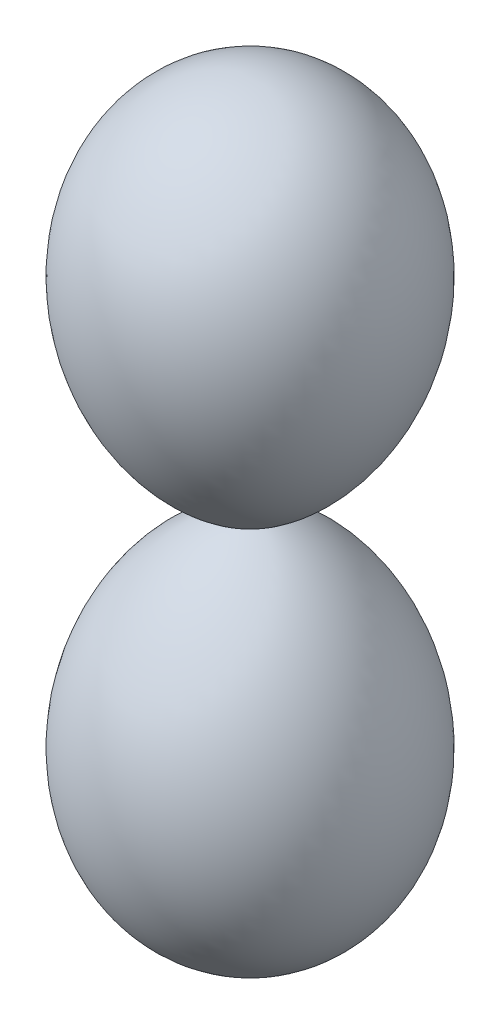
from build123d import *


with BuildPart() as part:
    # Sketch → Revolve 2 (revolve)
    with BuildSketch(Plane.XY):
        with BuildLine():
            Line((0, -238.732414638), (0, 238.732414638))
            add(Edge.make_bspline(
                [(0, -238.732414638), (0.158232077, -238.732414638), (0.457894285, -238.731206454), (1.334117241, -238.725769625), (1.734828689, -238.711272515), (2.784257101, -238.689529601), (3.327391603, -238.660544182), (4.233552235, -238.624320653), (4.899254924, -238.580864502), (5.710431999, -238.530182308), (6.439587273, -238.472281735), (7.209860068, -238.407171527), (7.960170326, -238.334861506), (8.906756192, -238.235487824), (10.036917619, -238.101885459), (11.35511682, -237.925140188), (12.856201705, -237.694636601), (14.35335864, -237.435761168), (15.844951617, -237.148667084), (17.331115392, -236.833522986), (18.810947316, -236.49051295), (20.284181817, -236.119835734), (21.750180597, -235.721704634), (23.208545184, -235.296346025), (24.658748895, -234.844000473), (27.181554623, -234.005610229), (30.028480641, -232.941574968), (33.877647352, -231.313146468), (38.643678262, -228.951040666), (43.263561166, -226.311100964), (48.321877745, -222.936136953), (53.140623494, -219.227520162), (57.704770636, -215.210068516), (62.002106448, -210.908728408), (66.023002229, -206.34820432), (69.760150606, -201.55267159), (73.208302609, -196.545553623), (76.363996406, -191.349371223), (79.225302096, -185.985647266), (81.791587919, -180.474849778), (84.063303795, -174.836385458), (86.041791902, -169.088614521), (87.729126693, -163.24886785), (89.12796924, -157.333494347), (90.241441271, -151.357929953), (91.07302349, -145.336752282), (91.626467605, -139.28375109), (91.975538229, -131.694052432), (91.854220286, -122.57372715), (90.94318358, -111.966525473), (88.880638241, -99.976126526), (85.830270711, -88.198658823), (81.824681155, -76.711163807), (76.895202809, -65.588766025), (71.071730211, -54.907072226), (64.382638242, -44.744327002), (56.854788086, -35.185318162), (48.513526697, -26.325007127), (39.382746375, -18.27765176), (29.558231014, -11.239903165), (20.330535609, -6.088717432), (12.744356959, -2.909332584), (7.123412248, -1.197500191), (3.89252896, -0.472067618), (2.073354847, -0.174511201), (0.897060134, -0.049334904), (0.384889492, -0.01495543), (0.237494877, -0.007187224), (0.128470358, -0.002714026), (0.05953241, -0.000834124), (0.021580243, -0.000158546), (0.006014563, -2.8815e-05), (0.002263326, -7.099e-06), (0.000617382, -2.078e-06), (0.000279755, 1.504e-06), (0.002101495, 6.27e-06), (0.005896718, 2.6536e-05), (0.011280533, 7.1356e-05), (0.03052891, 0.000303178), (0.07128192, 0.001104008), (0.141479089, 0.003230096), (0.24777748, 0.007660446), (0.387344121, 0.015233331), (0.765293896, 0.040289232), (1.763239686, 0.136675824), (3.363876167, 0.376889225), (6.364669635, 1.000735296), (11.598751558, 2.511836497), (18.836172109, 5.391762543), (27.774160676, 10.152677885), (37.363515, 16.712075114), (46.502114439, 24.426974972), (54.883388299, 32.95523492), (62.485054599, 42.183225458), (69.283344343, 52.016928437), (75.253240179, 62.373869961), (80.368208592, 73.178372549), (84.600317133, 84.358179263), (87.920268821, 95.842121808), (90.297507074, 107.55788476), (91.700492456, 119.43033589), (92.097083128, 131.379537209), (91.455224234, 143.319005121), (89.957859881, 153.674462156), (87.988294388, 162.41929114), (85.882244431, 169.582315917), (83.916086078, 175.222534781), (81.666685245, 180.756040038), (79.13281253, 186.165357552), (76.314090208, 191.432009653), (73.211150775, 196.53654793), (69.825827462, 201.458562748), (66.161389924, 206.176695653), (62.222761953, 210.668751131), (58.016778902, 214.911821756), (53.552452266, 218.882473277), (49.430077295, 222.097725623), (45.751011746, 224.653876321), (42.59327587, 226.643607308), (40.014270283, 228.148330474), (37.384863679, 229.563229389), (34.707761211, 230.885627234), (31.985680912, 232.112943585), (29.221802141, 233.242724228), (26.418988572, 234.272652025), (23.581078377, 235.200564677), (20.710697992, 236.024473512), (18.175232529, 236.652813301), (15.985249783, 237.12426262), (14.153480676, 237.471954287), (12.679168186, 237.722839922), (11.208596914, 237.946314415), (9.719217015, 238.142249375), (8.389746292, 238.294919882), (7.153731816, 238.412172888), (6.12300284, 238.500961568), (5.103850777, 238.567316177), (4.341729331, 238.622635351), (3.158590285, 238.661371893), (3.150434819, 238.687663655), (1.543383231, 238.704962194), (1.828658325, 238.716035183), (1.124266464, 238.726416156), (0.488179432, 238.731030377), (0.195571604, 238.732414638), (0, 238.732414638)],
                knots=[0.083333053, 0.083333053, 0.083333053, 0.083333053, 0.083333053, 0.084293516, 0.085253978, 0.086214441, 0.087174904, 0.088135367, 0.089095829, 0.090056292, 0.091016755, 0.091977218, 0.092937681, 0.093898143, 0.094858606, 0.096779532, 0.098700457, 0.100621379, 0.102542302, 0.104463224, 0.106384146, 0.108305068, 0.11022599, 0.112146912, 0.114067834, 0.115988764, 0.117909694, 0.125593413, 0.129435273, 0.137118956, 0.144802638, 0.152486357, 0.160170076, 0.16785378, 0.175537483, 0.183221222, 0.190904962, 0.198588662, 0.206272363, 0.213956102, 0.221639841, 0.229323565, 0.23700729, 0.244691011, 0.252374732, 0.260058468, 0.267742203, 0.275425937, 0.283109671, 0.298477139, 0.313844622, 0.329212081, 0.344579569, 0.359947039, 0.375314543, 0.390682009, 0.406049508, 0.421416993, 0.436784411, 0.452151817, 0.467519373, 0.482431932, 0.490114312, 0.493661553, 0.497208794, 0.499171934, 0.499431691, 0.499642768, 0.499805121, 0.499918642, 0.499983361, 0.49999205, 0.499996395, 0.499998567, 0.499999653, 0.500000739, 0.500004372, 0.500008004, 0.50001527, 0.5000298, 0.500101086, 0.50021458, 0.500370257, 0.500568082, 0.50080801, 0.502130554, 0.505440227, 0.5087499, 0.516302203, 0.529656725, 0.544757487, 0.559857801, 0.574958657, 0.590059081, 0.605159498, 0.620260077, 0.635360588, 0.650461262, 0.665561729, 0.680662288, 0.69576286, 0.710863376, 0.725963924, 0.74106446, 0.75616496, 0.763715212, 0.771265463, 0.778815745, 0.786366027, 0.793916323, 0.801466618, 0.809016812, 0.816567007, 0.824117311, 0.831667615, 0.839217863, 0.846768112, 0.854318329, 0.858093437, 0.861868545, 0.86564369, 0.869418836, 0.873193981, 0.876969126, 0.88074424, 0.884519353, 0.888294467, 0.892069581, 0.895844698, 0.897732256, 0.899619815, 0.901507373, 0.903394932, 0.90528249, 0.907170049, 0.908357161, 0.909544273, 0.910731386, 0.911918498, 0.91310561, 0.913699166, 0.914292723, 0.914886279, 0.915479835, 0.916666947, 0.916666947, 0.916666947, 0.916666947, 0.916666947], degree=4))
        make_face()
    revolve(axis=Axis((0, 238.732414638, 0), (0, -1, 0)))


solid = part.part
